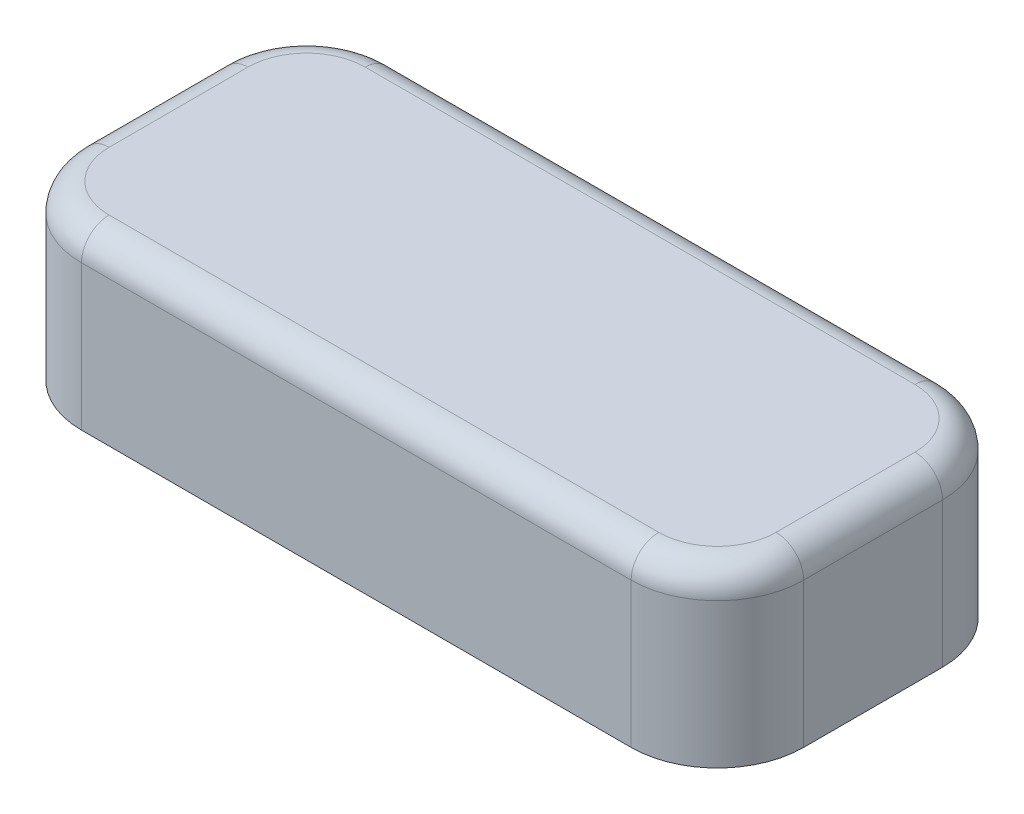
from build123d import *

# Parameters (mm, degrees)
SKETCH_1_R        = 2.8
EXTRUDE_1_DEPTH   = 8
EXTRUDE_1_2_DEPTH = 8
EXTRUDE_1_3_DEPTH = 8
SKETCH_2_W        = 41.8625
SKETCH_2_H        = 18.05
EXTRUDE_2_DEPTH   = 1
SKETCH_3_W        = 41.8625
SKETCH_3_H        = 18.05
SKETCH_3_W_2      = 39.8625
SKETCH_3_H_2      = 16.05
EXTRUDE_3_DEPTH   = 9
SKETCH_4_W        = 7.50625
SKETCH_4_H        = 1.2
SKETCH_4_W_2      = 1.2
SKETCH_4_H_2      = 5.825
SKETCH_4_W_3      = 5.825
EXTRUDE_4_DEPTH   = 2.5
FILLET_1_R        = 5
FILLET_2_R        = 1.6


with BuildPart() as part:
    # 草图1 → 凸台-拉伸1 (new body)
    with BuildSketch(Plane(origin=(0, 0, 0), x_dir=(1, 0, 0), z_dir=(0, 1, 0))):
        with Locations(Location((0, 0, 0), (0, 0, 270))):
            Circle(SKETCH_1_R)
        Polygon((2.2, 0.6), (2.2, -0.6), (0.6, -0.6), (0.6, -2.2), (-0.6, -2.2), (-0.6, -0.6), (-2.2, -0.6), (-2.2, 0.6), (-0.6, 0.6), (-0.6, 2.2), (0.6, 2.2), (0.6, 0.6), align=None, mode=Mode.SUBTRACT)
    extrude(amount=-EXTRUDE_1_DEPTH)

    # 草图2 → 凸台-拉伸2 (add)
    with BuildSketch(Plane(origin=(0, 0, 0), x_dir=(1, 0, 0), z_dir=(0, 1, 0))):
        Rectangle(SKETCH_2_W, SKETCH_2_H)
    extrude(amount=EXTRUDE_2_DEPTH)

    # 草图3 → 凸台-拉伸3 (add)
    with BuildSketch(Plane(origin=(0, 0, 0), x_dir=(1, 0, 0), z_dir=(0, 1, 0))):
        Rectangle(SKETCH_3_W, SKETCH_3_H)
        Rectangle(SKETCH_3_W_2, SKETCH_3_H_2, mode=Mode.SUBTRACT)
    extrude(amount=-EXTRUDE_3_DEPTH)



with BuildPart() as body_2:
    # 草图1 → Extrude 1 2 (new body)
    with BuildSketch(Plane(origin=(0, 0, 0), x_dir=(1, 0, 0), z_dir=(0, 1, 0))):
        with Locations(Location((-11.90625, 0, 0), (0, 0, 270))):
            Circle(SKETCH_1_R)
        Polygon((-14.10625, -0.6), (-14.10625, 0.6), (-12.50625, 0.6), (-12.50625, 2.2), (-11.30625, 2.2), (-11.30625, 0.6), (-9.70625, 0.6), (-9.70625, -0.6), (-11.30625, -0.6), (-11.30625, -2.2), (-12.50625, -2.2), (-12.50625, -0.6), align=None, mode=Mode.SUBTRACT)
    extrude(amount=-EXTRUDE_1_2_DEPTH)


with BuildPart() as body_3:
    # 草图1 → Extrude 1 3 (new body)
    with BuildSketch(Plane(origin=(0, 0, 0), x_dir=(1, 0, 0), z_dir=(0, 1, 0))):
        with Locations(Location((11.90625, 0, 0), (0, 0, 270))):
            Circle(SKETCH_1_R)
        Polygon((9.70625, 0.6), (9.70625, -0.6), (11.30625, -0.6), (11.30625, -2.2), (12.50625, -2.2), (12.50625, -0.6), (14.10625, -0.6), (14.10625, 0.6), (12.50625, 0.6), (12.50625, 2.2), (11.30625, 2.2), (11.30625, 0.6), align=None, mode=Mode.SUBTRACT)
    extrude(amount=-EXTRUDE_1_3_DEPTH)


with BuildPart() as part_1:
    add(part.part)

    add(body_2.part)  # 凸台-拉伸4 merges body 2

    add(body_3.part)  # 凸台-拉伸4 merges body 3
    # 草图4 → 凸台-拉伸4 (add)
    with BuildSketch(Plane(origin=(0, 0, 0), x_dir=(1, 0, 0), z_dir=(0, 1, 0))):
        with Locations((5.953125, 0)):
            Rectangle(SKETCH_4_W, SKETCH_4_H)
        with Locations((11.90625, 5.1125)):
            Rectangle(SKETCH_4_W_2, SKETCH_4_H_2)
        with Locations((11.90625, -5.1125)):
            Rectangle(SKETCH_4_W_2, SKETCH_4_H_2)
        with Locations((17.01875, 0)):
            Rectangle(SKETCH_4_W_3, SKETCH_4_H)
        with Locations((0, 5.1125)):
            Rectangle(SKETCH_4_W_2, SKETCH_4_H_2)
        with Locations((-5.953125, 0)):
            Rectangle(SKETCH_4_W, SKETCH_4_H)
        with Locations((0, -5.1125)):
            Rectangle(SKETCH_4_W_2, SKETCH_4_H_2)
        with Locations((-11.90625, 5.1125)):
            Rectangle(SKETCH_4_W_2, SKETCH_4_H_2)
        with Locations((-11.90625, -5.1125)):
            Rectangle(SKETCH_4_W_2, SKETCH_4_H_2)
        with Locations((-17.01875, 0)):
            Rectangle(SKETCH_4_W_3, SKETCH_4_H)
    extrude(amount=-EXTRUDE_4_DEPTH)

    # 圆角1
    fillet_1_edges = [part_1.edges().sort_by_distance(p)[0] for p in [
        (20.93125, -4, 9.025),
        (20.93125, -4, -9.025),
        (-20.93125, -4, -9.025),
        (-20.93125, -4, 9.025),
        (-19.93125, -4.5, 8.025),
        (-19.93125, -4.5, -8.025),
        (19.93125, -4.5, -8.025),
        (19.93125, -4.5, 8.025),
    ]]
    fillet(fillet_1_edges, radius=FILLET_1_R)

    # 圆角2
    fillet_2_edges = [part_1.edges().sort_by_distance(p)[0] for p in [
        (5.953125, 0, -8.025),
        (13.71875, 0, 8.025),
        (19.93125, 0, -1.8125),
        (-5.953125, 0, -8.025),
        (5.953125, 0, 8.025),
        (-13.71875, 0, -8.025),
        (-5.953125, 0, 8.025),
        (-19.93125, 0, 1.8125),
        (0, 1, -9.025),
        (20.93125, 1, 0),
        (-20.93125, 1, 0),
        (0, 1, 9.025),
        (-19.466783906, 1, 7.560533906),
        (-19.466783906, 1, -7.560533906),
        (19.466783906, 1, 7.560533906),
        (19.466783906, 1, -7.560533906),
        (13.71875, 0, -8.025),
        (18.466783906, 0, -6.560533906),
        (19.93125, 0, 1.8125),
        (18.466783906, 0, 6.560533906),
        (-13.71875, 0, 8.025),
        (-19.93125, 0, -1.8125),
        (-18.466783906, 0, -6.560533906),
        (-18.466783906, 0, 6.560533906),
    ]]
    fillet(fillet_2_edges, radius=FILLET_2_R)


solid = part_1.part
